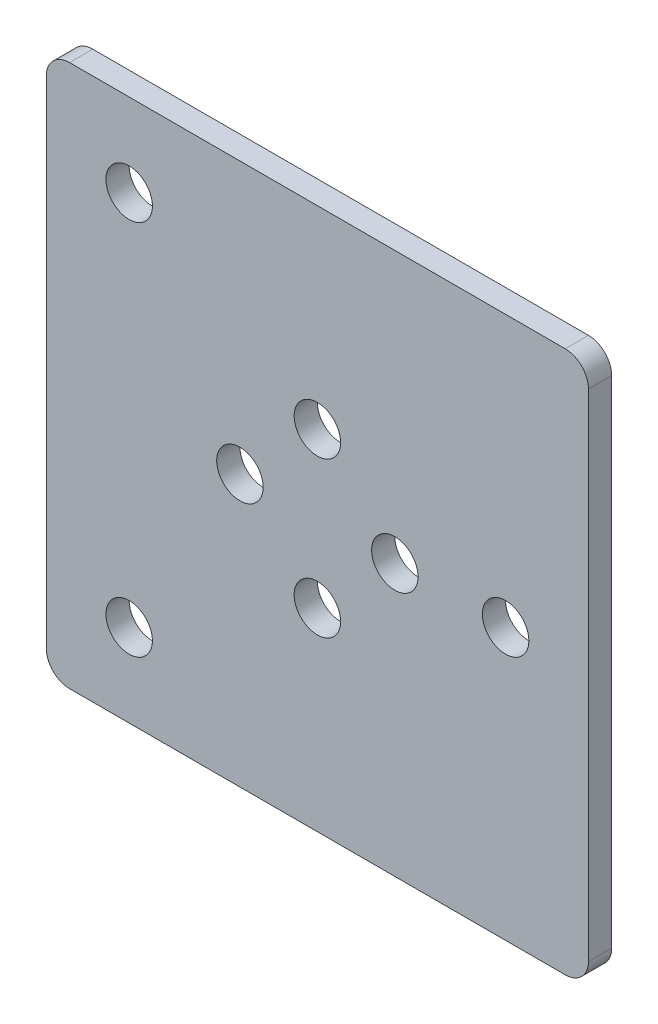
from build123d import *

# Parameters (mm, degrees)
SKETCH3_W           = 70
SKETCH3_H           = 70
SKETCH3_R           = 3
BOSS_EXTRUDE2_DEPTH = 3
FILLET2_R           = 3


with BuildPart() as part:
    # Sketch3 → Boss-Extrude2 (new body)
    with BuildSketch(Plane.XY):
        Rectangle(SKETCH3_W, SKETCH3_H)
        with Locations((0, 10)):
            Circle(SKETCH3_R, mode=Mode.SUBTRACT)
        with Locations((-24.3, 24.3)):
            Circle(SKETCH3_R, mode=Mode.SUBTRACT)
        with Locations((10, 0)):
            Circle(SKETCH3_R, mode=Mode.SUBTRACT)
        with Locations((0, -10)):
            Circle(SKETCH3_R, mode=Mode.SUBTRACT)
        with Locations((-10, 0)):
            Circle(SKETCH3_R, mode=Mode.SUBTRACT)
        with Locations((-24.3, -24.3)):
            Circle(SKETCH3_R, mode=Mode.SUBTRACT)
        with Locations((24.3, 0)):
            Circle(SKETCH3_R, mode=Mode.SUBTRACT)
    extrude(amount=BOSS_EXTRUDE2_DEPTH)

    # Fillet2
    fillet2_edges = [part.edges().sort_by_distance(p)[0] for p in [
        (35, -35, 1.5),
        (-35, -35, 1.5),
        (-35, 35, 1.5),
        (35, 35, 1.5),
    ]]
    fillet(fillet2_edges, radius=FILLET2_R)


solid = part.part
